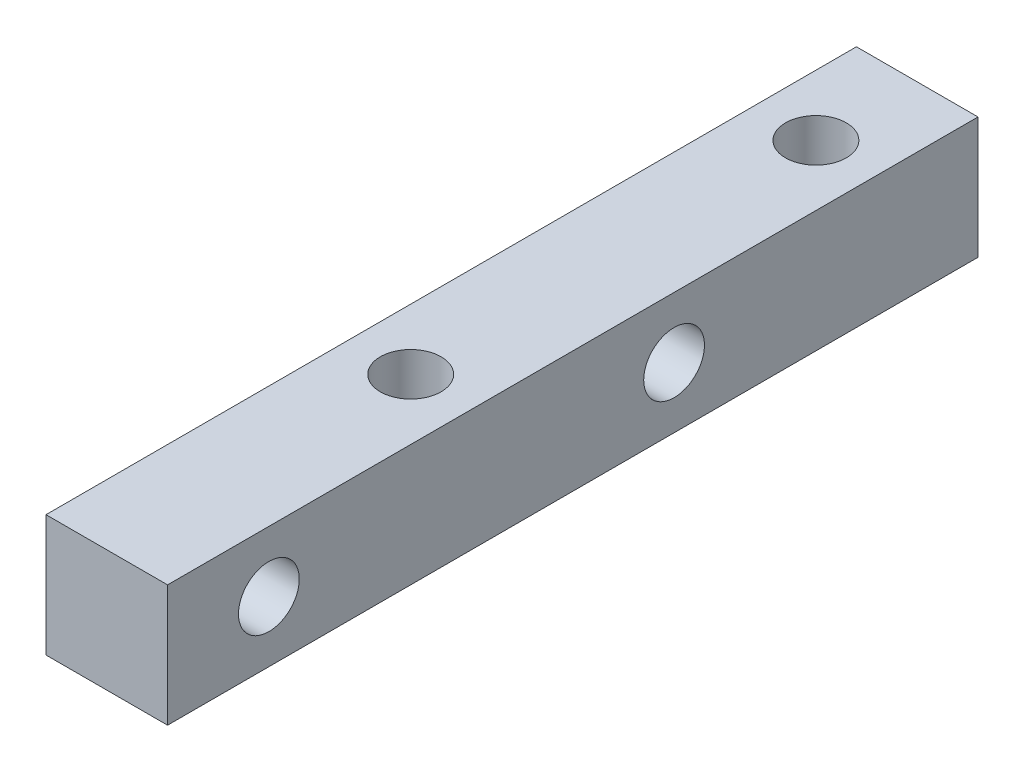
from build123d import *

# Parameters (mm, degrees)
SKETCH_1_W          = 6
SKETCH_1_H          = 6
EXTRUDE_1_DEPTH     = 40
SKETCH_2_R          = 1.5
CUT_EXTRUDE_1_DEPTH = 50
SKETCH_3_R          = 1.5
CUT_EXTRUDE_2_DEPTH = 50


with BuildPart() as part:
    # 草图1 → 凸台-拉伸1 (new body)
    with BuildSketch(Plane.XY):
        with Locations((3, 3)):
            Rectangle(SKETCH_1_W, SKETCH_1_H)
    extrude(amount=EXTRUDE_1_DEPTH)

    # 草图2 → 切除-拉伸1 (cut)
    with BuildSketch(Plane(origin=(0, 6, 0), x_dir=(1, 0, 0), z_dir=(0, 1, 0))):
        with Locations(Location((3, -5, 0), (0, 0, 270))):
            Circle(SKETCH_2_R)
        with Locations(Location((3, -25, 0), (0, 0, 270))):
            Circle(SKETCH_2_R)
    extrude(amount=-CUT_EXTRUDE_1_DEPTH, mode=Mode.SUBTRACT)

    # 草图3 → 切除-拉伸2 (cut)
    with BuildSketch(Plane.ZY):
        with Locations((35, 3)):
            Circle(SKETCH_3_R)
        with Locations((15, 3)):
            Circle(SKETCH_3_R)
    extrude(amount=-CUT_EXTRUDE_2_DEPTH, mode=Mode.SUBTRACT)


solid = part.part
